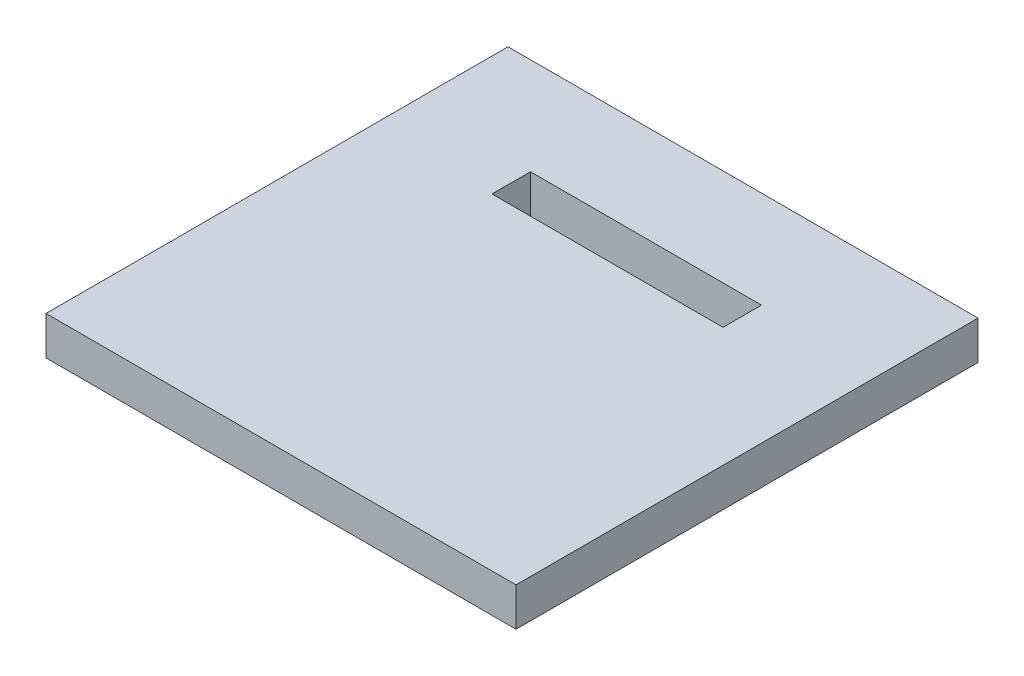
from build123d import *

# Parameters (mm, degrees)
SKETCH1_W           = 38.7604
SKETCH1_H           = 38.1
SKETCH1_W_2         = 19.05
SKETCH1_H_2         = 3.175
BOSS_EXTRUDE1_DEPTH = 3.175


with BuildPart() as part:
    # Sketch1 → Boss-Extrude1 (new body)
    with BuildSketch(Plane(origin=(0, 0, 0), x_dir=(1, 0, 0), z_dir=(0, 1, 0))):
        with Locations((19.3802, 19.05)):
            Rectangle(SKETCH1_W, SKETCH1_H)
        with Locations((19.3802, 28.5115)):
            Rectangle(SKETCH1_W_2, SKETCH1_H_2, mode=Mode.SUBTRACT)
    extrude(amount=BOSS_EXTRUDE1_DEPTH)


solid = part.part
